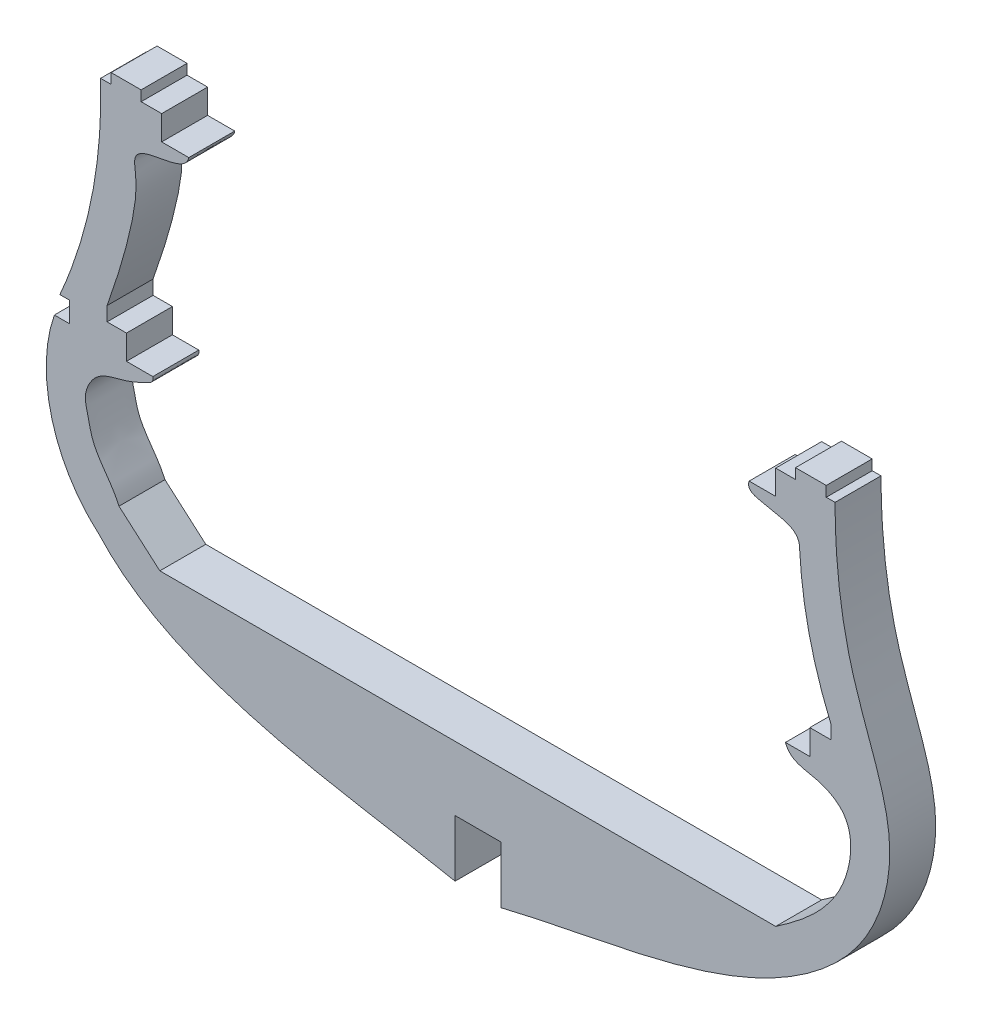
from build123d import *

# Parameters (mm, degrees)
EXTRUDE_1_DEPTH = 8


with BuildPart() as part:
    # 草图1 → 凸台-拉伸1 (new body)
    with BuildSketch(Plane.XY):
        with BuildLine():
            Line((1736.631230142, 666.835487009), (1843.839672203, 666.835487009))
            add(Edge.make_bspline(
                [(1843.839672203, 666.835487009), (1849.048933079, 670.401023189), (1856.658351579, 676.430723923), (1857.432479693, 689.497936137), (1850.935749798, 693.148827691), (1846.435069185, 693.006837672), (1845.535507871, 695.422224725)],
                knots=[0, 0, 0, 0, 0.482118343, 0.698635587, 0.830471272, 1, 1, 1, 1], degree=3))
            Line((1845.535507871, 695.422224725), (1849.781732968, 695.422224725))
            Line((1849.781732968, 695.422224725), (1849.781732968, 699.78011457))
            Line((1849.781732968, 699.78011457), (1853.487957014, 699.78011457))
            Line((1853.487957014, 699.78011457), (1853.487957014, 702.058530991))
            add(Edge.make_bspline(
                [(1853.487957014, 702.058530991), (1848.632575503, 713.452012152), (1847.997134595, 725.919707363)],
                knots=[0, 0, 0, 1, 1, 1], degree=2))
            add(Edge.make_bspline(
                [(1839.213544794, 731.659486678), (1838.724126411, 730.189974813), (1841.254627091, 729.652870368), (1844.699750935, 728.947927357), (1848.016526713, 728.277135284), (1847.997134595, 725.919707363)],
                knots=[0, 0, 0, 0, 0.293171802, 0.50974717, 1, 1, 1, 1], degree=3))
            Line((1839.213544794, 731.659486678), (1843.839672203, 731.659486678))
            Line((1843.839672203, 731.659486678), (1843.839672203, 735.928181623))
            Line((1843.839672203, 735.928181623), (1847.284472905, 735.928181623))
            Line((1847.284472905, 735.928181623), (1847.284472905, 737.717355689))
            Line((1847.284472905, 737.717355689), (1852.639591083, 737.717355689))
            Line((1852.639591083, 737.717355689), (1852.639591083, 735.928181623))
            Line((1852.639591083, 735.928181623), (1854.169624848, 735.928181623))
            add(Edge.make_bspline(
                [(1854.169624848, 735.928181623), (1854.184750531, 728.08871062), (1855.251359205, 716.626457615), (1860.654263864, 701.800018069), (1865.259346512, 688.66974675), (1861.050490469, 672.479807915), (1838.899590966, 651.988779605), (1813.473138043, 650.060778678), (1796.028061186, 645.744745728)],
                knots=[0, 0, 0, 0, 0.175102649, 0.250263336, 0.350923187, 0.478482673, 0.593542959, 1, 1, 1, 1], degree=3))
            Line((1796.028061186, 645.744745728), (1796.028061186, 655.644745728))
            Line((1796.028061186, 655.644745728), (1788.027824374, 655.644745728))
            Line((1788.027824374, 655.644745728), (1788.027824374, 645.744745728))
            add(Edge.make_bspline(
                [(1725.873845255, 667.225811474), (1731.604689548, 660.841165814), (1752.2841737, 650.961536096), (1774.485672575, 648.486012245), (1788.027824374, 645.744745728)],
                knots=[0, 0, 0, 0, 0.379945895, 1, 1, 1, 1], degree=3))
            add(Edge.make_bspline(
                [(1718.273283511, 696.225448414), (1714.79207945, 686.289172356), (1717.90007318, 674.15682682), (1725.873845255, 667.225811474)],
                knots=[0, 0, 0, 0, 1, 1, 1, 1], degree=3))
            Line((1718.273283511, 696.225448414), (1720.941532576, 696.225448414))
            Line((1720.941532576, 696.225448414), (1720.941532576, 699.78011457))
            Line((1720.941532576, 699.78011457), (1719.232185519, 699.78011457))
            add(Edge.make_bspline(
                [(1726.313411794, 735.928181623), (1726.903187357, 717.225749991), (1719.232185519, 699.78011457)],
                knots=[0, 0, 0, 1, 1, 1], degree=2))
            Line((1726.313411794, 735.928181623), (1728.150941915, 735.928181623))
            Line((1728.150941915, 735.928181623), (1728.150941915, 737.717355689))
            Line((1728.150941915, 737.717355689), (1733.373395943, 737.717355689))
            Line((1733.373395943, 737.717355689), (1733.373395943, 735.928181623))
            Line((1733.373395943, 735.928181623), (1736.951744074, 735.928181623))
            Line((1736.951744074, 735.928181623), (1736.951744074, 731.659486678))
            Line((1736.951744074, 731.659486678), (1741.672851851, 731.659486678))
            add(Edge.make_bspline(
                [(1727.454262635, 702.238593182), (1729.449259744, 707.795547847), (1733.026527348, 719.143968784), (1732.328852077, 725.139001902), (1731.622046596, 730.152048234), (1741.017183857, 728.281931394), (1741.672851851, 731.659486678)],
                knots=[0, 0, 0, 0, 0.486670009, 0.533234204, 0.615120311, 1, 1, 1, 1], degree=3))
            Line((1727.454262635, 702.238593182), (1727.454262635, 699.78011457))
            Line((1727.454262635, 699.78011457), (1730.822392388, 699.78011457))
            Line((1730.822392388, 699.78011457), (1730.822392388, 695.512859548))
            Line((1730.822392388, 695.512859548), (1735.415347768, 695.512859548))
            add(Edge.make_bspline(
                [(1735.415347768, 695.512859548), (1735.595580626, 694.569376065), (1734.433647206, 694.140332046), (1732.632189929, 693.209154562), (1729.849058882, 692.151261696), (1726.355479126, 691.577122461), (1724.280306312, 689.04937985), (1723.360323254, 686.486036576), (1724.213408653, 683.794569359), (1725.09930324, 678.816166654), (1728.327866867, 675.900488276), (1729.521089433, 673.026704357)],
                knots=[0, 0, 0, 0, 0.068770033, 0.107166972, 0.20107238, 0.358564254, 0.431585741, 0.50956037, 0.612881734, 0.696964415, 1, 1, 1, 1], degree=3))
            Line((1729.521089433, 673.026704357), (1736.631230142, 666.835487009))
        make_face()
    extrude(amount=EXTRUDE_1_DEPTH)


solid = part.part
